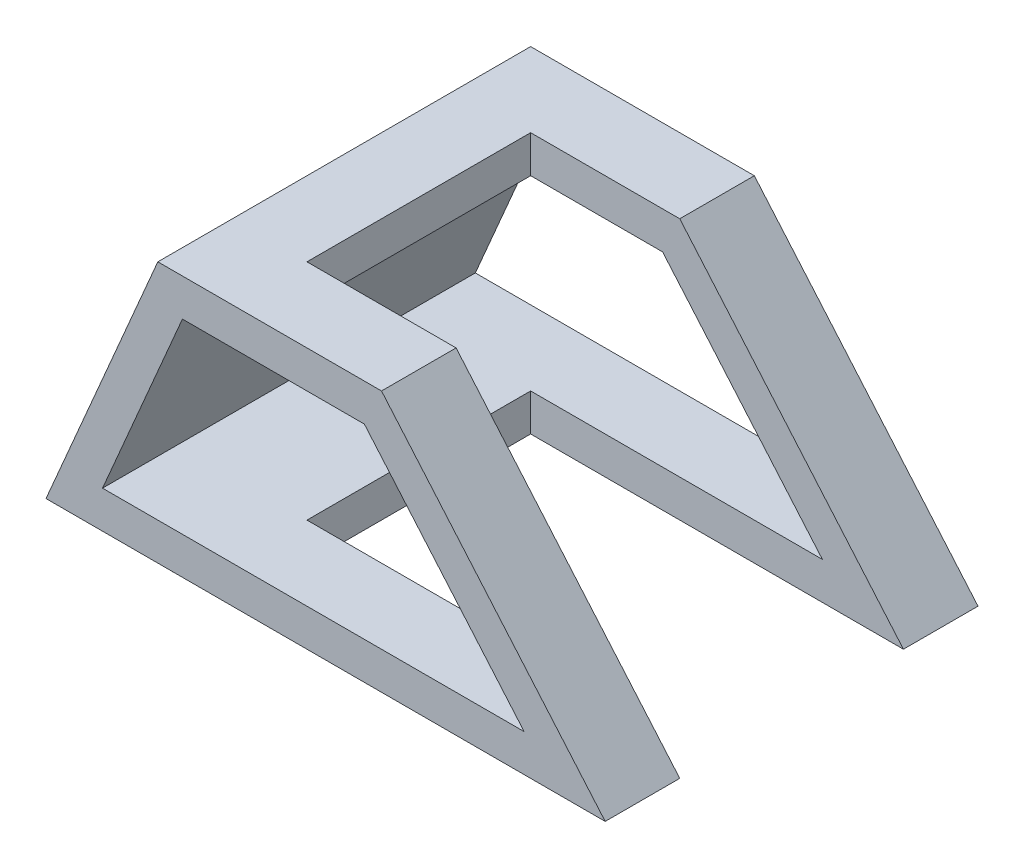
from build123d import *

# Parameters (mm, degrees)
BOSS_EXTRU_1_DEPTH      = 100
ESQUISSE5_W             = 100
ESQUISSE5_H             = 60
ENL_V_MAT_EXTRU_2_DEPTH = 10
ESQUISSE6_W             = 60
ESQUISSE6_H             = 79.024666777
ENL_V_MAT_EXTRU_3_DEPTH = 10
ESQUISSE7_W             = 40
ESQUISSE7_H             = 60
ENL_V_MAT_EXTRU_4_DEPTH = 10


with BuildPart() as part:
    # Esquisse1 → Boss.-Extru.1 (new body)
    with BuildSketch(Plane.XY):
        Polygon((0, 0), (150, 0), (90, 70), (30, 70), align=None)
        Polygon((36.59396158, 60), (15.165390151, 10), (128.257793632, 10), (85.400650775, 60), align=None, mode=Mode.SUBTRACT)
    extrude(amount=-BOSS_EXTRU_1_DEPTH)

    # Esquisse5 → Enlèv. mat.-Extru.2 (cut)
    with BuildSketch(Plane.XZ):
        with Locations((100, -50)):
            Rectangle(ESQUISSE5_W, ESQUISSE5_H)
    extrude(amount=-ENL_V_MAT_EXTRU_2_DEPTH, mode=Mode.SUBTRACT)

    # Esquisse6 → Enlèv. mat.-Extru.3 (cut)
    with BuildSketch(Plane(origin=(86.470588235, 74.117647059, 0), x_dir=(0, 0, -1), z_dir=(0.7592566023652966, 0.6507913734559686, 0))):
        with Locations((50, -44.935594833)):
            Rectangle(ESQUISSE6_W, ESQUISSE6_H)
    extrude(amount=-ENL_V_MAT_EXTRU_3_DEPTH, mode=Mode.SUBTRACT)

    # Esquisse7 → Enlèv. mat.-Extru.4 (cut)
    with BuildSketch(Plane(origin=(0, 70, 0), x_dir=(1, 0, 0), z_dir=(0, 1, 0))):
        with Locations((70, 50)):
            Rectangle(ESQUISSE7_W, ESQUISSE7_H)
    extrude(amount=-ENL_V_MAT_EXTRU_4_DEPTH, mode=Mode.SUBTRACT)


solid = part.part
